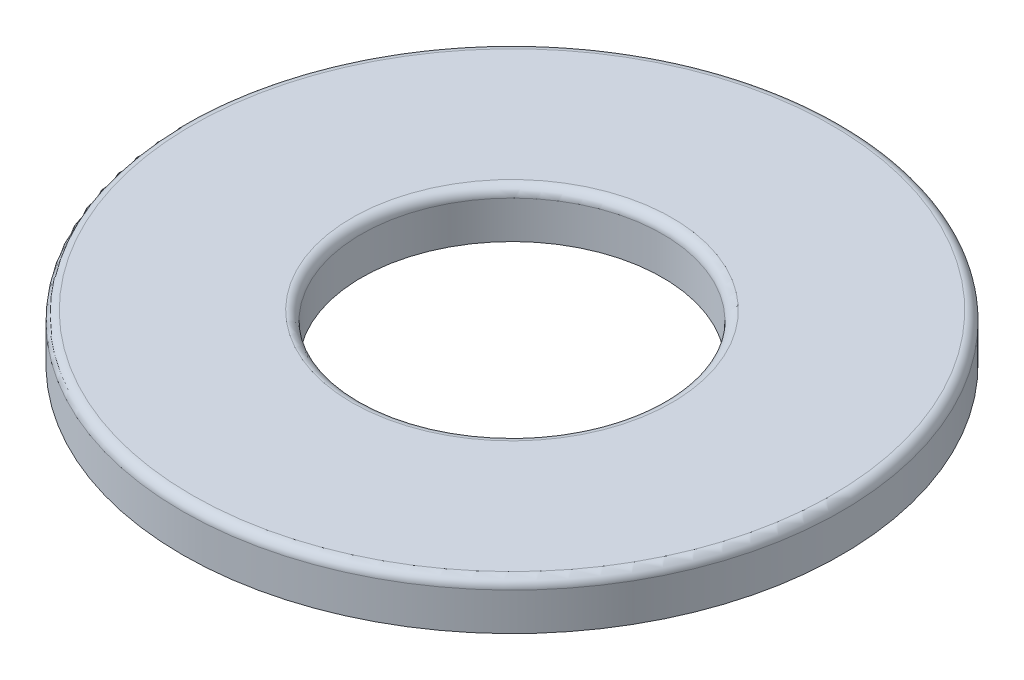
from build123d import *

# Parameters (mm, degrees)
SZKIC1_R                    = 3.5
SZKIC1_R_2                  = 1.6
DODANIE_WYCI_GNI_CIE1_DEPTH = 0.5
ZAOKR_GLENIE1_R             = 0.1


with BuildPart() as part:
    # Szkic1 → Dodanie-wyciągnięcie1 (new body)
    with BuildSketch(Plane(origin=(0, 0, 0), x_dir=(1, 0, 0), z_dir=(0, 1, 0))):
        with Locations(Location((0, 0, 0), (0, 0, 270))):
            Circle(SZKIC1_R)
        with Locations(Location((0, 0, 0), (0, 0, 270))):
            Circle(SZKIC1_R_2, mode=Mode.SUBTRACT)
    extrude(amount=DODANIE_WYCI_GNI_CIE1_DEPTH)

    # Zaokrąglenie1
    zaokr_glenie1_edges = [part.edges().sort_by_distance(p)[0] for p in [
        (0, 0.5, -3.5),
        (0, 0.5, -1.6),
    ]]
    fillet(zaokr_glenie1_edges, radius=ZAOKR_GLENIE1_R)


solid = part.part
